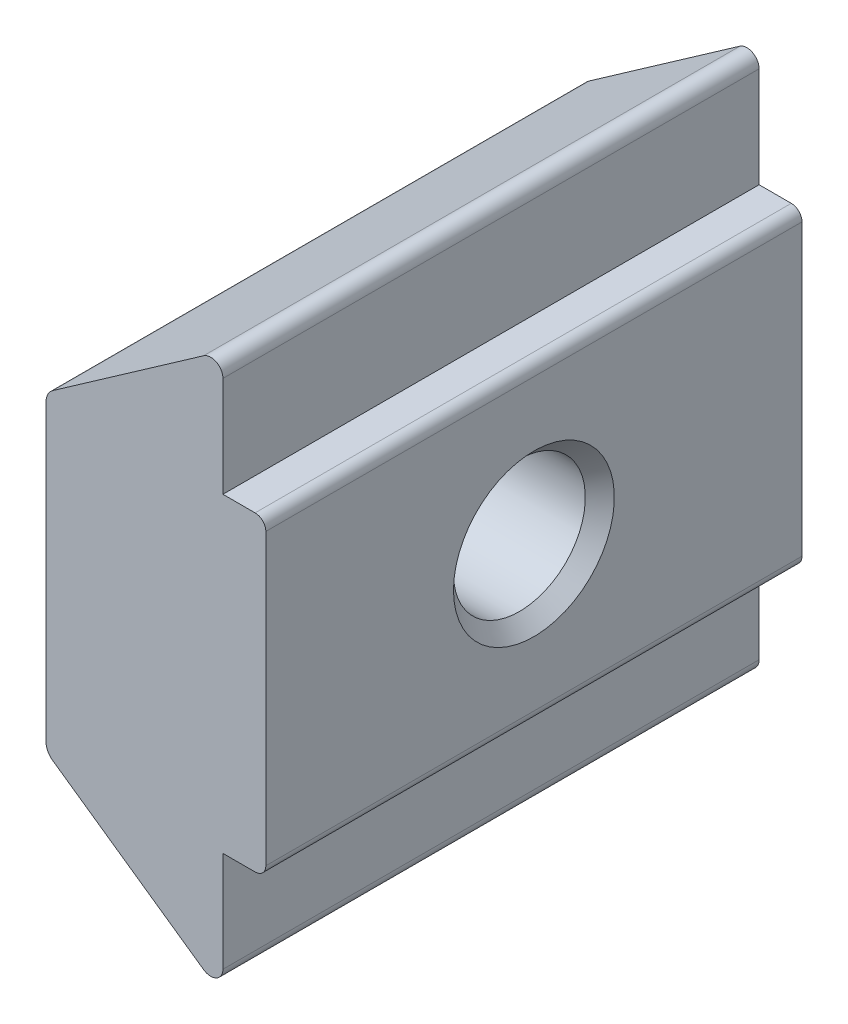
from build123d import *

# Parameters (mm, degrees)
BOSS_EXTRUDE1_DEPTH      = 5
BOSS_EXTRUDE1_DEPTH_BACK = 5


with BuildPart() as part:
    # Sketch1 → Boss-Extrude1 (new, two sides: drawn at the far end of the back side and taken through both)
    with BuildSketch(Plane.XY.offset(-BOSS_EXTRUDE1_DEPTH_BACK)):
        with BuildLine():
            Line((-3.972038703, -2.989572908), (-1.15890604, -4.958765772))
            ThreePointArc((-1.15890604, -4.958765772), (-0.922761342, -4.974218454), (-0.8, -4.7719))
            Line((-0.8, -4.7719), (-0.8, -2.9))
            Line((-0.8, -2.9), (-0.2, -2.9))
            ThreePointArc((-0.2, -2.9), (-0.058578644, -2.841421356), (0, -2.7))
            Line((0, -2.7), (0, 2.7))
            ThreePointArc((0, 2.7), (-0.058578644, 2.841421356), (-0.2, 2.9))
            Line((-0.2, 2.9), (-0.8, 2.9))
            Line((-0.8, 2.9), (-0.8, 4.7719))
            ThreePointArc((-0.8, 4.7719), (-0.922761342, 4.974218454), (-1.15890604, 4.958765772))
            Line((-1.15890604, 4.958765772), (-3.972038703, 2.989572908))
            ThreePointArc((-3.972038703, 2.989572908), (-4.066093603, 2.882346446), (-4.1, 2.743803332))
            Line((-4.1, 2.743803332), (-4.1, -2.743803332))
            ThreePointArc((-4.1, -2.743803332), (-4.066093603, -2.882346446), (-3.972038703, -2.989572908))
        make_face()
    extrude(amount=BOSS_EXTRUDE1_DEPTH + BOSS_EXTRUDE1_DEPTH_BACK)

    # Sketch2 → Cut-Revolve1 (revolve, cut)
    with BuildSketch(Plane.XY):
        Polygon((-4.1, 0), (-4.1, 1.5), (-3.8295, 1.2295), (-0.2705, 1.2295), (0, 1.5), (0, 0), align=None)
    revolve(axis=Axis((0, 0, 0), (-1, 0, 0)), mode=Mode.SUBTRACT)


solid = part.part
